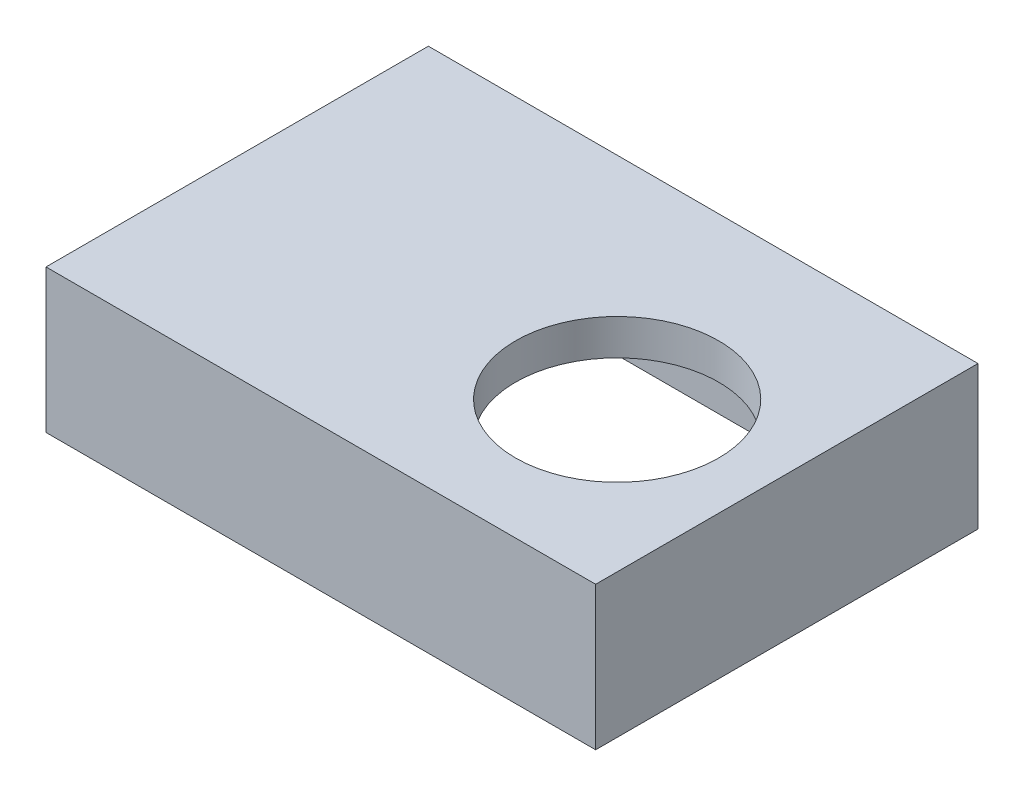
from build123d import *

# Parameters (mm, degrees)
SKETCH2_W           = 40
SKETCH2_H           = 26
BOSS_EXTRUDE1_DEPTH = 3
SKETCH3_R           = 8.5
CUT_EXTRUDE1_DEPTH  = 3
SKETCH4_W           = 26
SKETCH4_H           = 3
BOSS_EXTRUDE2_DEPTH = 3
SKETCH5_W           = 26
SKETCH5_H           = 3
BOSS_EXTRUDE3_DEPTH = 3
SKETCH6_W           = 46
SKETCH6_H           = 3
BOSS_EXTRUDE4_DEPTH = 3
SKETCH7_W           = 46
SKETCH7_H           = 3
BOSS_EXTRUDE5_DEPTH = 3
SKETCH8_W           = 41
SKETCH8_H           = 27
BOSS_EXTRUDE6_DEPTH = 9
BOSS_EXTRUDE7_DEPTH = 6.6
SKETCH10_W          = 17.601141336
SKETCH10_H          = 6
CUT_EXTRUDE2_DEPTH  = 6.6


with BuildPart() as part:
    # Sketch2 → Boss-Extrude1 (new body)
    with BuildSketch(Plane(origin=(0, 0, 0), x_dir=(1, 0, 0), z_dir=(0, 1, 0))):
        Rectangle(SKETCH2_W, SKETCH2_H)
    extrude(amount=BOSS_EXTRUDE1_DEPTH)

    # Sketch3 → Cut-Extrude1 (cut)
    with BuildSketch(Plane(origin=(0, 3, 0), x_dir=(1, 0, 0), z_dir=(0, 1, 0))):
        with Locations(Location((10.5, -1.7, 0), (0, 0, 270))):
            Circle(SKETCH3_R)
    extrude(amount=-CUT_EXTRUDE1_DEPTH, mode=Mode.SUBTRACT)

    # Sketch4 → Boss-Extrude2 (add)
    with BuildSketch(Plane(origin=(20, 0, 0), x_dir=(0, 0, -1), z_dir=(1, 0, 0))):
        with Locations((0, 1.5)):
            Rectangle(SKETCH4_W, SKETCH4_H)
    extrude(amount=BOSS_EXTRUDE2_DEPTH)

    # Sketch5 → Boss-Extrude3 (add)
    with BuildSketch(Plane.ZY.offset(20)):
        with Locations((0, 1.5)):
            Rectangle(SKETCH5_W, SKETCH5_H)
    extrude(amount=BOSS_EXTRUDE3_DEPTH)

    # Sketch6 → Boss-Extrude4 (add)
    with BuildSketch(Plane.XY.offset(13)):
        with Locations((0, 1.5)):
            Rectangle(SKETCH6_W, SKETCH6_H)
    extrude(amount=BOSS_EXTRUDE4_DEPTH)

    # Sketch7 → Boss-Extrude5 (add)
    with BuildSketch(Plane(origin=(0, 0, -13), x_dir=(-1, 0, 0), z_dir=(0, 0, -1))):
        with Locations((0, 1.5)):
            Rectangle(SKETCH7_W, SKETCH7_H)
    extrude(amount=BOSS_EXTRUDE5_DEPTH)

    # Sketch8 → Boss-Extrude6 (add)
    with BuildSketch(Plane.XZ):
        Polygon((23, 13), (23, 16), (20, 16), (-20, 16), (-23, 16), (-23, 13), (-23, -13), (-23, -16), (-20, -16), (20, -16), (23, -16), (23, -13), align=None)
        Rectangle(SKETCH8_W, SKETCH8_H, mode=Mode.SUBTRACT)
    extrude(amount=BOSS_EXTRUDE6_DEPTH)

    # Sketch9 → Boss-Extrude7 (add)
    with BuildSketch(Plane.XZ):
        Polygon((20.5, 9.5), (16.5, 13.5), (20.5, 13.5), align=None)
        Polygon((20.5, -5.5), (16.5, -13.5), (20.5, -13.5), align=None)
    extrude(amount=BOSS_EXTRUDE7_DEPTH)

    # Sketch10 → Cut-Extrude2 (cut)
    with BuildSketch(Plane.ZY.offset(23)):
        with Locations((-0.508683185, -6)):
            Rectangle(SKETCH10_W, SKETCH10_H)
    extrude(amount=-CUT_EXTRUDE2_DEPTH, mode=Mode.SUBTRACT)


solid = part.part
